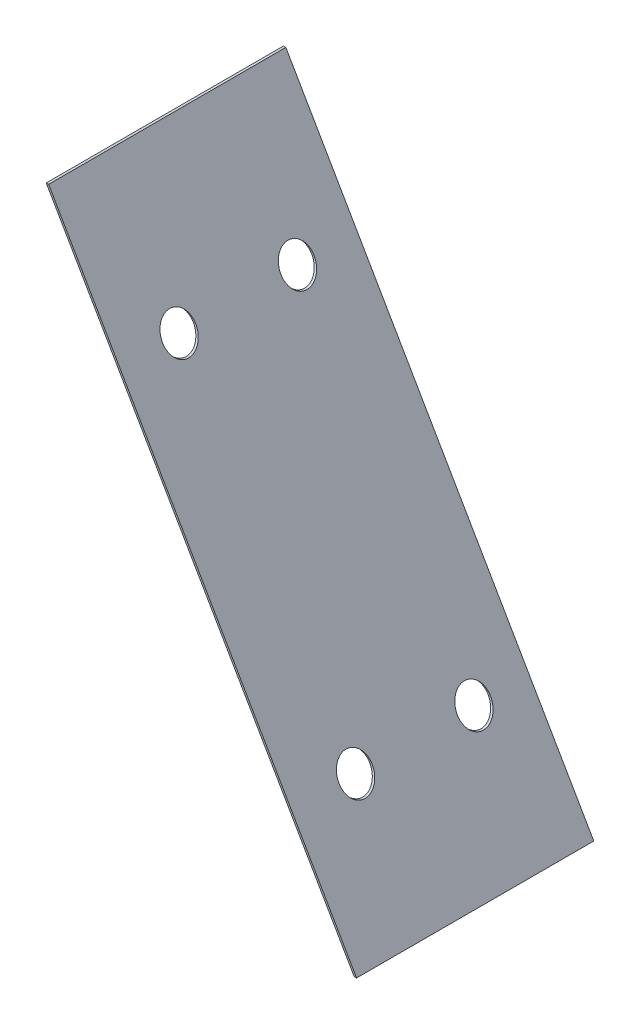
from build123d import *

# Parameters (mm, degrees)
BOSS_EXTRUDE1_DEPTH = 25.05
SKETCH3_R           = 1.75
CUT_EXTRUDE1_DEPTH  = 73.231514091
SKETCH4_R           = 1.75
CUT_EXTRUDE2_DEPTH  = 73.231514091


with BuildPart() as part:
    # Sketch1 → Boss-Extrude1 (new body)
    with BuildSketch(Plane.XY):
        Polygon((0, 0), (0.254034118, 0), (32.772967712, -56.324445192), (32.518933594, -56.324445192), align=None)
    extrude(amount=-BOSS_EXTRUDE1_DEPTH)

    # Sketch3 → Cut-Extrude1 (cut, through all)
    with BuildSketch(Plane.ZY.offset(4.876016361)):
        with Locations(Location((-18.775, -13, 0), (0, 0, 90))):
            Circle(SKETCH3_R)
        with Locations(Location((-6.275, -13, 0), (0, 0, 90))):
            Circle(SKETCH3_R)
    extrude(amount=-CUT_EXTRUDE1_DEPTH, mode=Mode.SUBTRACT)

    # Sketch4 → Cut-Extrude2 (cut, through all)
    with BuildSketch(Plane(origin=(37.648984073, 0, 0), x_dir=(0, 0, -1), z_dir=(1, 0, 0))):
        with Locations(Location((6.75, -44.449445192, 0), (0, 0, 270))):
            Circle(SKETCH4_R)
        with Locations(Location((19.25, -44.449445192, 0), (0, 0, 270))):
            Circle(SKETCH4_R)
    extrude(amount=-CUT_EXTRUDE2_DEPTH, mode=Mode.SUBTRACT)


solid = part.part
